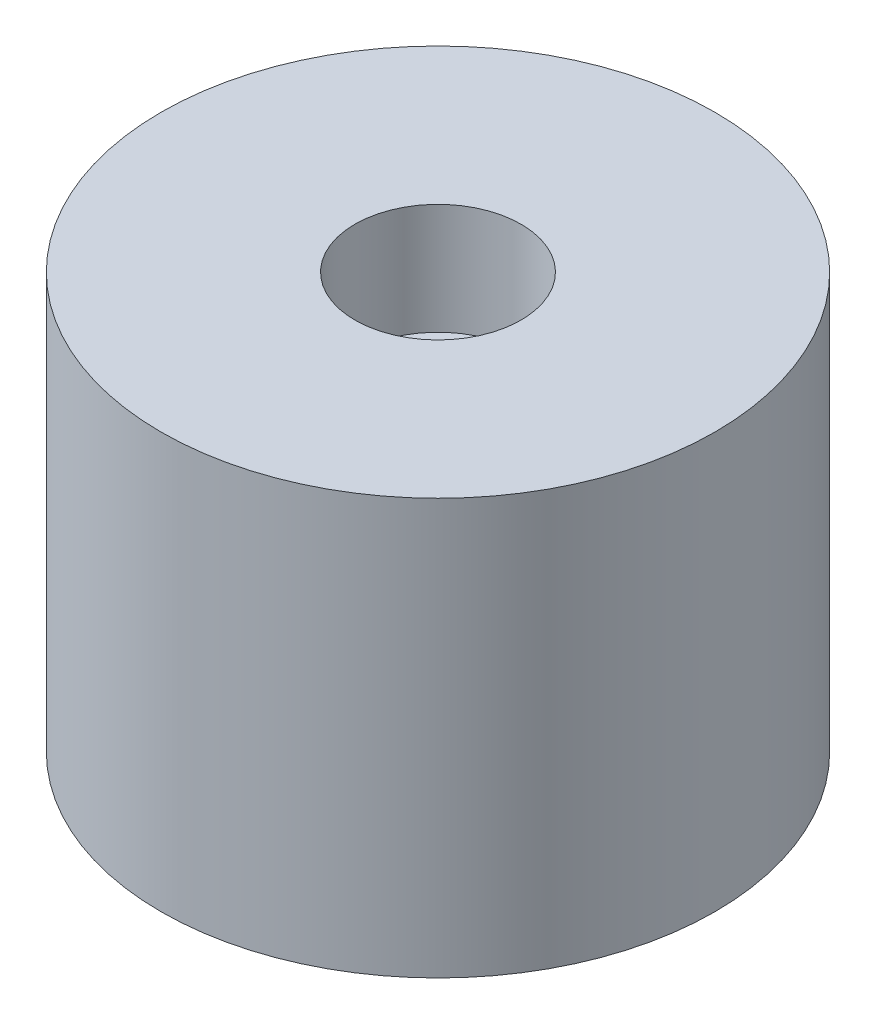
from build123d import *


with BuildPart() as part:
    # 草图1 → 旋转3 (revolve)
    with BuildSketch(Plane.XY, mode=Mode.PRIVATE) as revolve_3_sk:
        Polygon((0, 3.5), (0, 0), (10, 0), (10, 7.5), (3, 7.5), (3, 3.5), align=None)
        Polygon((10, 0), (0, 0), (0, -3.5), (3, -3.5), (3, -7.5), (10, -7.5), align=None)
    revolve(revolve_3_sk.sketch.rotate(Axis((0, 3.5, 0), (0, -1, 0)), 180), axis=Axis((0, 3.5, 0), (0, -1, 0)))


solid = part.part
